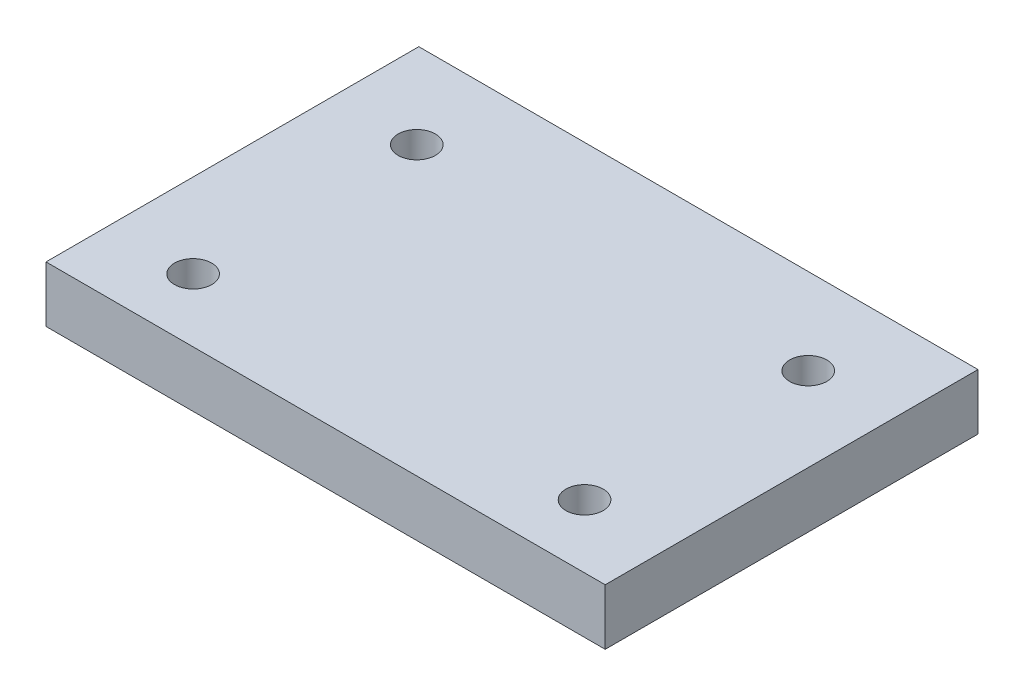
from build123d import *

# Parameters (mm, degrees)
SKETCH1_W           = 30
SKETCH1_H           = 20
SKETCH1_R           = 1
BOSS_EXTRUDE2_DEPTH = 3


with BuildPart() as part:
    # Sketch1 → Boss-Extrude2 (new body)
    with BuildSketch(Plane(origin=(0, 0, 0), x_dir=(1, 0, 0), z_dir=(0, 1, 0))):
        with Locations((15, 10)):
            Rectangle(SKETCH1_W, SKETCH1_H)
        with Locations(Location((4.5, 3.392127344, 0), (0, 0, 270))):
            Circle(SKETCH1_R, mode=Mode.SUBTRACT)
        with Locations(Location((25.5, 3.392127344, 0), (0, 0, 270))):
            Circle(SKETCH1_R, mode=Mode.SUBTRACT)
        with Locations(Location((25.5, 15.392127344, 0), (0, 0, 270))):
            Circle(SKETCH1_R, mode=Mode.SUBTRACT)
        with Locations(Location((4.5, 15.392127344, 0), (0, 0, 270))):
            Circle(SKETCH1_R, mode=Mode.SUBTRACT)
    extrude(amount=BOSS_EXTRUDE2_DEPTH)


solid = part.part
